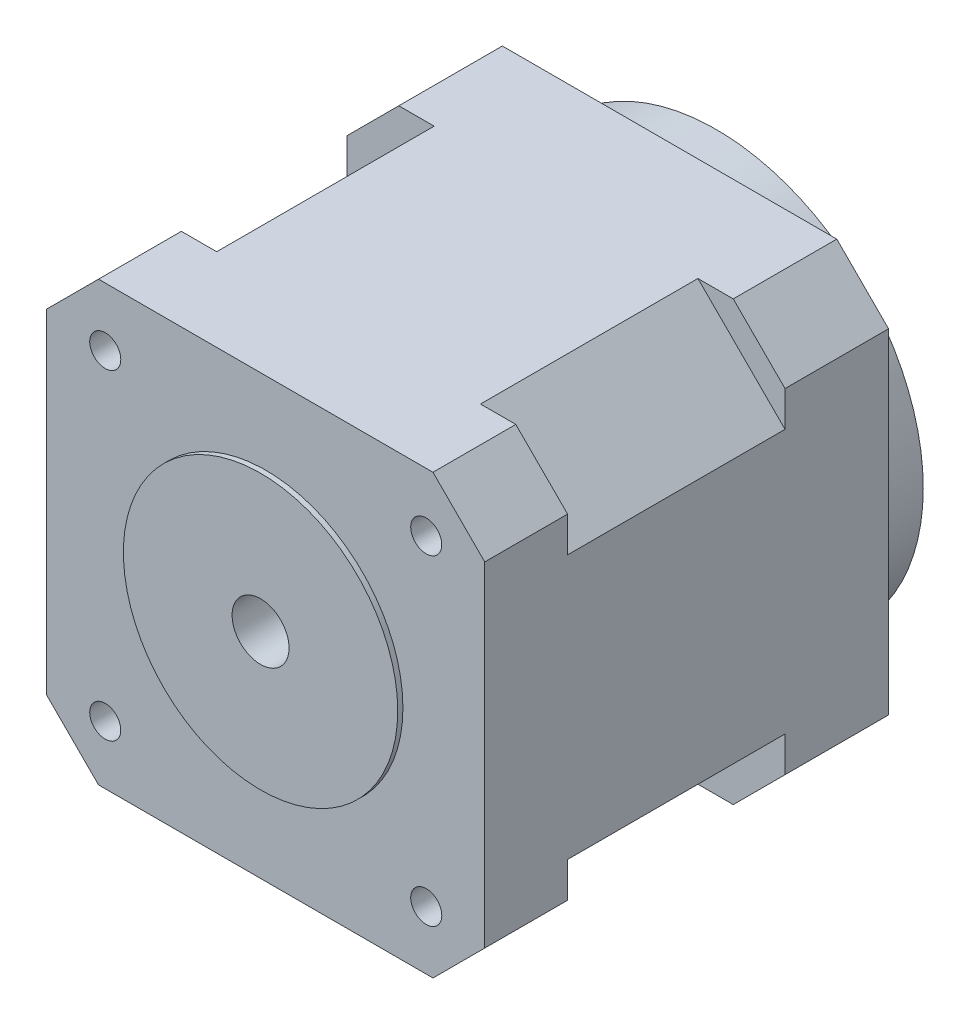
from build123d import *

# Parameters (mm, degrees)
SKETCH2_W               = 42.3
SKETCH2_H               = 42.3
BOSS_EXTRUDE5_DEPTH     = 39
CHAMFER4_SIZE           = 5
CUT_EXTRUDE1_START      = -8
CUT_EXTRUDE1_DEPTH      = 21
SKETCH5_R               = 20
BOSS_EXTRUDE6_DEPTH     = 4.5
SKETCH7_R               = 1.5
CUT_EXTRUDE3_DEPTH      = 4.5
SKETCH8_R               = 13.24793055
BOSS_EXTRUDE7_DEPTH     = 0.5
CUT_EXTRUDE2_DEPTH      = 53.791050378
CUT_EXTRUDE2_DEPTH_BACK = 4.5
SKETCH6_R               = 2.75


with BuildPart() as part:
    # Sketch2 → Boss-Extrude5 (new body)
    with BuildSketch(Plane.XY):
        Rectangle(SKETCH2_W, SKETCH2_H)
    extrude(amount=BOSS_EXTRUDE5_DEPTH)

    # Chamfer4
    chamfer4_edges = [part.edges().sort_by_distance(p)[0] for p in [
        (21.15, -21.15, 19.5),
        (-21.15, -21.15, 19.5),
        (-21.15, 21.15, 19.5),
        (21.15, 21.15, 19.5),
    ]]
    chamfer(chamfer4_edges, length=CHAMFER4_SIZE)

    # Sketch3 → Cut-Extrude1 (cut)
    with BuildSketch(Plane.XY.offset(39).offset(CUT_EXTRUDE1_START)):
        Polygon((-21.15, 21.15), (-21.15, 12.738640345), (-16.944320172, 16.944320172), (-12.738640345, 21.15), align=None)
        Polygon((21.15, -12.738640345), (21.15, -21.15), (12.738640345, -21.15), (16.944320172, -16.944320172), align=None)
        Polygon((12.738640345, 21.15), (21.15, 21.15), (21.15, 12.738640345), (16.944320172, 16.944320172), align=None)
        Polygon((-12.738640345, -21.15), (-21.15, -21.15), (-21.15, -12.738640345), (-16.944320172, -16.944320172), align=None)
    extrude(amount=-CUT_EXTRUDE1_DEPTH, mode=Mode.SUBTRACT)

    # Sketch5 → Boss-Extrude6 (add)
    with BuildSketch(Plane(origin=(0, 0, 0), x_dir=(-1, 0, 0), z_dir=(0, 0, -1))):
        Circle(SKETCH5_R)
    extrude(amount=BOSS_EXTRUDE6_DEPTH)

    # Sketch7 → Cut-Extrude3 (cut)
    with BuildSketch(Plane.XY.offset(39)):
        with Locations((-15.5, 15.5)):
            Circle(SKETCH7_R)
        with Locations(Location((-15.5, -15.5, 0), (0, 0, 180))):
            Circle(SKETCH7_R)
        with Locations(Location((15.5, 15.5, 0), (0, 0, 180))):
            Circle(SKETCH7_R)
        with Locations((15.5, -15.5)):
            Circle(SKETCH7_R)
    extrude(amount=-CUT_EXTRUDE3_DEPTH, mode=Mode.SUBTRACT)

    # Sketch8 → Boss-Extrude7 (add)
    with BuildSketch(Plane.XY.offset(39)):
        Circle(SKETCH8_R)
    extrude(amount=BOSS_EXTRUDE7_DEPTH)

    # Sketch6 → Cut-Extrude2 (cut, two sides: drawn at the far end of the back side and taken through both)
    with BuildSketch(Plane.XY.offset(39).offset(-CUT_EXTRUDE2_DEPTH_BACK)):
        Circle(SKETCH6_R)
    extrude(amount=CUT_EXTRUDE2_DEPTH + CUT_EXTRUDE2_DEPTH_BACK, mode=Mode.SUBTRACT)


solid = part.part
